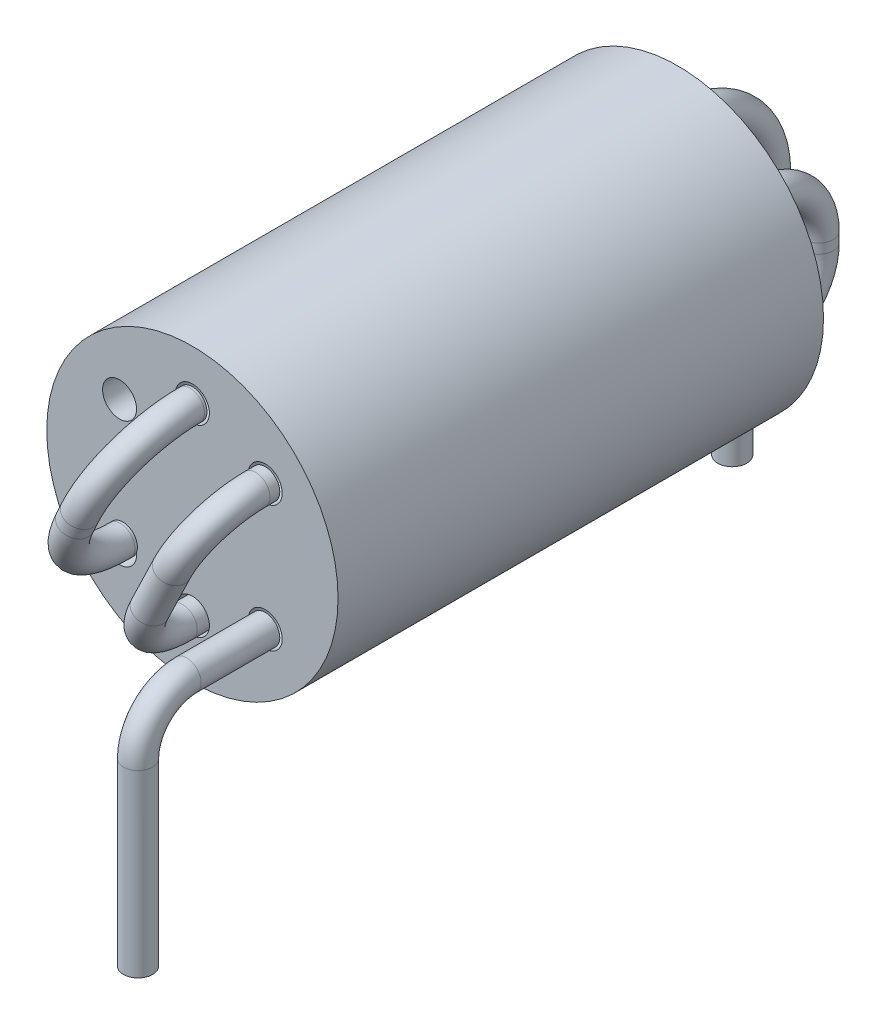
from build123d import *

# Parameters (mm, degrees)
ESQUISSE1_R             = 3
BOSS_EXTRU_1_DEPTH      = 10
ESQUISSE2_R             = 0.35
ENL_V_MAT_EXTRU_1_DEPTH = 11.862780491
ESQUISSE4_R             = 0.3
ESQUISSE5_R             = 0.3
ESQUISSE7_R             = 0.3
ESQUISSE9_R             = 0.3
ESQUISSE12_R            = 0.3
ESQUISSE14_R            = 0.3


with BuildPart() as part:
    # Esquisse1 → Boss.-Extru.1 (new body)
    with BuildSketch(Plane.XY):
        Circle(ESQUISSE1_R)
    extrude(amount=BOSS_EXTRU_1_DEPTH)

    # Esquisse2 → Enlèv. mat.-Extru.1 (cut, through all)
    with BuildSketch(Plane.XY.offset(10)):
        with Locations((-1.5, -1.3)):
            Circle(ESQUISSE2_R)
        with Locations((0, -1.809712682)):
            Circle(ESQUISSE2_R)
        with Locations((0, 1.976891683)):
            Circle(ESQUISSE2_R)
        with Locations((-1.5, 1.3)):
            Circle(ESQUISSE2_R)
        with Locations((1.5, 1.3)):
            Circle(ESQUISSE2_R)
        with Locations((1.5, -1.3)):
            Circle(ESQUISSE2_R)
    extrude(amount=-ENL_V_MAT_EXTRU_1_DEPTH, mode=Mode.SUBTRACT)

    # Balayage3: sweep along a path in Esquisse3
    with BuildLine(Plane(origin=(-0.74815796, 0.342469953, 0), x_dir=(0, 0, 1), z_dir=(-0.9092653192305453, 0.41621698577133376, 0))) as balayage3_path:
        Line((10, 1.797519047), (10.05, 1.797519047))
        ThreePointArc((10.05, 1.797519047), (11.18137085, 1.328889897), (11.65, 0.197519047))
        Line((11.65, 0.197519047), (11.65, -0.04550898))
        ThreePointArc((11.65, -0.04550898), (11.18137085, -1.176879829), (10.05, -1.64550898))
        Line((10.05, -1.64550898), (10, -1.64550898))
    # Esquisse4 → Balayage3 (sweep)
    with BuildSketch(Plane.XY.offset(10)):
        with Locations((-1.433046747, -1.153734295)):
            Circle(ESQUISSE4_R)
    sweep(path=balayage3_path.line)


with BuildPart() as body_2:
    # Balayage4: sweep along a path in Esquisse6
    with BuildLine(Plane(origin=(0, 0, 0), x_dir=(0, 0, -1), z_dir=(1, 0, 0))) as balayage4_path:
        Line((-10, -1.3), (-11.62, -1.3))
        ThreePointArc((-11.62, -1.3), (-12.327106781, -1.592893219), (-12.62, -2.3))
        Line((-12.62, -2.3), (-12.62, -6))
    # Esquisse5 → Balayage4 (sweep)
    with BuildSketch(Plane.XY.offset(10)):
        with Locations((1.5, -1.3)):
            Circle(ESQUISSE5_R)
    sweep(path=balayage4_path.line)


with BuildPart() as body_3:
    # Balayage6: sweep along a path in Esquisse8
    with BuildLine(Plane(origin=(0, 0, 0), x_dir=(0, 0, -1), z_dir=(1, 0, 0))) as balayage6_path:
        Line((0, 1.976891683), (0.1, 1.976891683))
        ThreePointArc((0.1, 1.976891683), (1.372792206, 1.449683889), (1.9, 0.176891683))
        Line((1.9, 0.176891683), (1.9, -0.009712682))
        ThreePointArc((1.9, -0.009712682), (1.372792206, -1.282504888), (0.1, -1.809712682))
        Line((0.1, -1.809712682), (0, -1.809712682))
    # Esquisse7 → Balayage6 (sweep)
    with BuildSketch(Plane(origin=(0, 0, 0), x_dir=(-1, 0, 0), z_dir=(0, 0, -1))):
        with Locations((0, 1.976891683)):
            Circle(ESQUISSE7_R)
    sweep(path=balayage6_path.line)


with BuildPart() as body_4:
    # Balayage7: sweep along a path in Esquisse11
    with BuildLine(Plane(origin=(-1.5, 0, 0), x_dir=(0, 0, -1), z_dir=(1, 0, 0))) as balayage7_path:
        Line((0, -1.3), (1.62, -1.3))
        ThreePointArc((1.62, -1.3), (2.327106781, -1.592893219), (2.62, -2.3))
        Line((2.62, -2.3), (2.62, -6))
    # Esquisse9 → Balayage7 (sweep)
    with BuildSketch(Plane(origin=(0, 0, 0), x_dir=(-1, 0, 0), z_dir=(0, 0, -1))):
        with Locations((1.5, -1.3)):
            Circle(ESQUISSE9_R)
    sweep(path=balayage7_path.line)


with BuildPart() as body_5:
    # Balayage8: sweep along a path in Esquisse13
    with BuildLine(Plane(origin=(1.5, 0, 0), x_dir=(0, 0, -1), z_dir=(1, 0, 0))) as balayage8_path:
        Line((0, 1.3), (0.2, 1.3))
        ThreePointArc((0.2, 1.3), (1.048528137, 0.948528137), (1.4, 0.1))
        Line((1.4, 0.1), (1.4, -0.1))
        ThreePointArc((1.4, -0.1), (1.048528137, -0.948528137), (0.2, -1.3))
        Line((0.2, -1.3), (0, -1.3))
    # Esquisse12 → Balayage8 (sweep)
    with BuildSketch(Plane(origin=(0, 0, 0), x_dir=(-1, 0, 0), z_dir=(0, 0, -1))):
        with Locations((-1.5, 1.3)):
            Circle(ESQUISSE12_R)
    sweep(path=balayage8_path.line)


with BuildPart() as body_6:
    # Balayage9: sweep along a path in Esquisse16
    with BuildLine(Plane(origin=(0.70816343, -0.341589482, 0), x_dir=(0, 0, 1), z_dir=(-0.9006922707216414, 0.43445763137766796, 0))) as balayage9_path:
        Line((10, 1.822586399), (10.2, 1.822586399))
        ThreePointArc((10.2, 1.822586399), (11.048528137, 1.471114536), (11.4, 0.622586399))
        Line((11.4, 0.622586399), (11.4, -0.429861811))
        ThreePointArc((11.4, -0.429861811), (11.048528137, -1.278389948), (10.2, -1.629861811))
        Line((10.2, -1.629861811), (9.804147518, -1.629861811))
    # Esquisse14 → Balayage9 (sweep)
    with BuildSketch(Plane.XY.offset(10)):
        with Locations((1.5, 1.3)):
            Circle(ESQUISSE14_R)
    sweep(path=balayage9_path.line)


solid = Compound([part.part, body_2.part, body_3.part, body_4.part, body_5.part, body_6.part])
